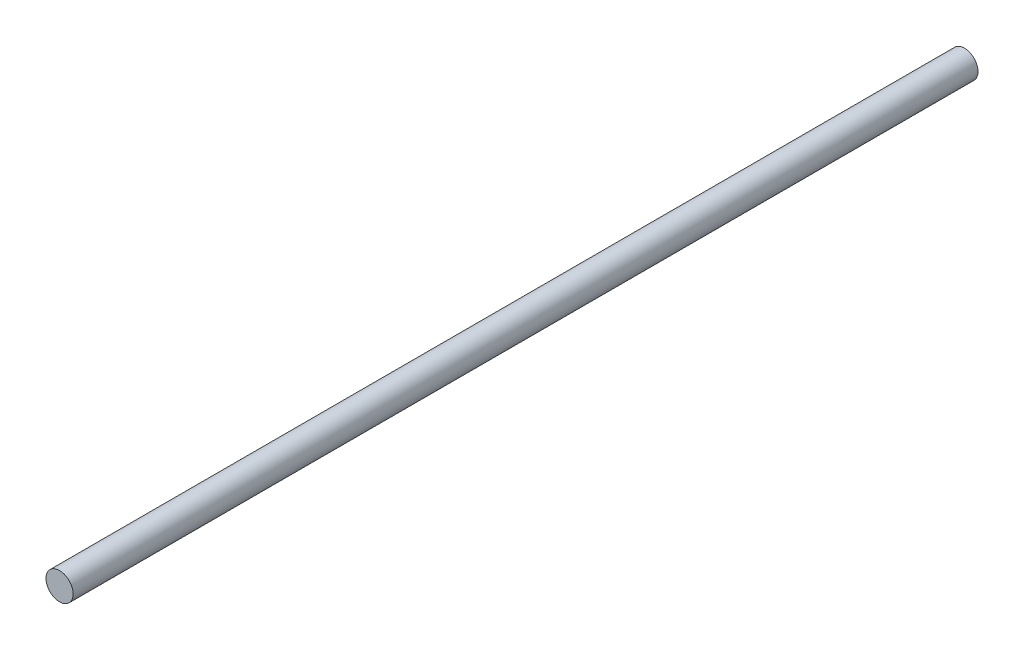
from build123d import *

# Parameters (mm, degrees)
CROQUIS1_R              = 3
SALIENTE_EXTRUIR1_DEPTH = 200


with BuildPart() as part:
    # Croquis1 → Saliente-Extruir1 (new body)
    with BuildSketch(Plane.XY):
        Circle(CROQUIS1_R)
    extrude(amount=SALIENTE_EXTRUIR1_DEPTH)


solid = part.part
